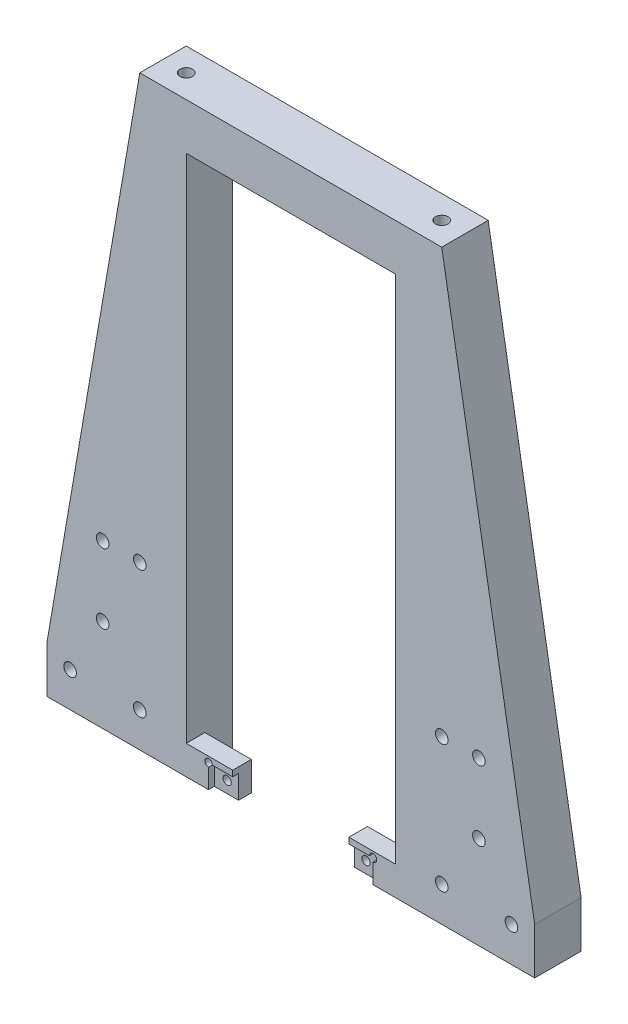
from build123d import *

# Parameters (mm, degrees)
SKETCH1_W              = 12.7
SKETCH1_H              = 12.7
BOSS_EXTRUDE1_DEPTH    = 28.575
SKETCH10_W             = 12.7
SKETCH10_H             = 12.7
BOSS_EXTRUDE6_DEPTH    = 160.3375
SKETCH54_W             = 12.7
SKETCH54_H             = 12.7
BOSS_EXTRUDE10_DEPTH   = 25.4
BOSS_EXTRUDE11_DEPTH   = 12.7
F_8_32_TAPPED_HOLE11_D = 3.4544
F_8_32_TAPPED_HOLE12_D = 3.4544
SKETCH11_W             = 5.08
SKETCH11_H             = 7.9375
BOSS_EXTRUDE12_DEPTH   = 12.7
SKETCH68_W             = 6.604
SKETCH68_H             = 6.35
CUT_EXTRUDE4_DEPTH     = 1.5875
F_4_40_TAPPED_HOLE3_D  = 2.2606
SKETCH71_R             = 1.016
CUT_EXTRUDE5_DEPTH     = 1.5875
F_8_32_TAPPED_HOLE13_D = 3.4544


with BuildPart() as part:
    # Sketch1 → Boss-Extrude1 (new body)
    with BuildSketch(Plane(origin=(0, 0, 0), x_dir=(0, 0, -1), z_dir=(1, 0, 0))):
        with Locations((6.35, -6.35)):
            Rectangle(SKETCH1_W, SKETCH1_H)
    boss_extrude1 = extrude(amount=BOSS_EXTRUDE1_DEPTH)

    # Sketch10 → Boss-Extrude6 (add)
    with BuildSketch(Plane(origin=(0, 0, 0), x_dir=(1, 0, 0), z_dir=(0, 1, 0))):
        with Locations((34.925, 6.35)):
            Rectangle(SKETCH10_W, SKETCH10_H)
    boss_extrude6 = extrude(amount=-BOSS_EXTRUDE6_DEPTH)

    # Sketch54 → Boss-Extrude10 (add)
    with BuildSketch(Plane(origin=(41.275, 0, 0), x_dir=(0, 0, -1), z_dir=(1, 0, 0))):
        with Locations((6.35, -153.9875)):
            Rectangle(SKETCH54_W, SKETCH54_H)
    boss_extrude10 = extrude(amount=BOSS_EXTRUDE10_DEPTH)

    # Sketch55 → Boss-Extrude11 (add)
    with BuildSketch(Plane.XY):
        Polygon((41.275, 0), (66.675, -147.6375), (66.675, -160.3375), (28.575, -160.3375), (28.575, -12.7), (0, -12.7), (0, 0), align=None)
    boss_extrude11 = extrude(amount=-BOSS_EXTRUDE11_DEPTH)

    # Sketch56 → #8-32 Tapped Hole8 (revolve, cut)
    with BuildSketch(Plane(origin=(34.925, 0, -6.35), x_dir=(0, 0, 1), z_dir=(1, 0, 0))):
        Polygon((0, 0), (0, 11.746446461), (1.7272, 10.70864), (1.7272, 0), align=None)
    f_8_32_tapped_hole8 = revolve(axis=Axis((34.925, 6.35, -6.35), (0, -1, 0)), mode=Mode.SUBTRACT)

    # #8-32 Tapped Hole11 (through all)
    with Locations(Plane.XY):
        with Locations((41.275, -115.8875), (51.435, -134.9375)):
            f_8_32_tapped_hole11 = Hole(F_8_32_TAPPED_HOLE11_D / 2)

    # #8-32 Tapped Hole12 (through all)
    with Locations(Plane(origin=(0, 0, -12.7), x_dir=(-1, 0, 0), z_dir=(0, 0, -1))):
        with Locations((-41.275, -150.8125), (-60.325, -150.8125)):
            f_8_32_tapped_hole12 = Hole(F_8_32_TAPPED_HOLE12_D / 2)

    # Sketch11 → Boss-Extrude12 (add)
    with BuildSketch(Plane.ZY.offset(-28.575)):
        with Locations((-2.54, -156.36875)):
            Rectangle(SKETCH11_W, SKETCH11_H)
    boss_extrude12 = extrude(amount=BOSS_EXTRUDE12_DEPTH)

    # Sketch68 → Cut-Extrude4 (cut)
    with BuildSketch(Plane.XY):
        with Locations((19.177, -157.1625)):
            Rectangle(SKETCH68_W, SKETCH68_H)
    cut_extrude4 = extrude(amount=-CUT_EXTRUDE4_DEPTH, mode=Mode.SUBTRACT)

    # #4-40 Tapped Hole3 (through all)
    with Locations(Plane.XY.offset(-1.5875)):
        with Locations((18.987190852, -157.172283572)):
            f_4_40_tapped_hole3 = Hole(F_4_40_TAPPED_HOLE3_D / 2)

    # Sketch71 → Cut-Extrude5 (cut)
    with BuildSketch(Plane.XY):
        with Locations((22.479, -153.9875)):
            Circle(SKETCH71_R)
    cut_extrude5 = extrude(amount=-CUT_EXTRUDE5_DEPTH, mode=Mode.SUBTRACT)

    # Sketch76 → #8-32 Tapped Hole14 (revolve, cut)
    with BuildSketch(Plane(origin=(34.925, -160.3375, -6.35), x_dir=(0, 0, -1), z_dir=(1, 0, 0))):
        Polygon((0, 0), (0, 11.746446461), (1.7272, 10.70864), (1.7272, 0), align=None)
    f_8_32_tapped_hole14 = revolve(axis=Axis((34.925, -166.6875, -6.35), (0, 1, 0)), mode=Mode.SUBTRACT)

    # #8-32 Tapped Hole13 (through all)
    with Locations(Plane.XY):
        with Locations((51.435, -115.8875)):
            f_8_32_tapped_hole13 = Hole(F_8_32_TAPPED_HOLE13_D / 2)

    # Mirror6: Boss-Extrude1, Boss-Extrude6, Boss-Extrude10, Boss-Extrude11, #8-32 Tapped Hole8, #8-32 Tapped Hole11, #8-32 Tapped Hole12, Boss-Extrude12, Cut-Extrude4, #4-40 Tapped Hole3, Cut-Extrude5, #8-32 Tapped Hole14, #8-32 Tapped Hole13 across Right Plane
    add(boss_extrude1.mirror(Plane(origin=(0, 0, 0), x_dir=(0, 0, -1), z_dir=(1, 0, 0))))
    add(boss_extrude6.mirror(Plane(origin=(0, 0, 0), x_dir=(0, 0, -1), z_dir=(1, 0, 0))))
    add(boss_extrude10.mirror(Plane(origin=(0, 0, 0), x_dir=(0, 0, -1), z_dir=(1, 0, 0))))
    add(boss_extrude11.mirror(Plane(origin=(0, 0, 0), x_dir=(0, 0, -1), z_dir=(1, 0, 0))))
    add(f_8_32_tapped_hole8.mirror(Plane(origin=(0, 0, 0), x_dir=(0, 0, -1), z_dir=(1, 0, 0))), mode=Mode.SUBTRACT)
    add(f_8_32_tapped_hole11.mirror(Plane(origin=(0, 0, 0), x_dir=(0, 0, -1), z_dir=(1, 0, 0))), mode=Mode.SUBTRACT)
    add(f_8_32_tapped_hole12.mirror(Plane(origin=(0, 0, 0), x_dir=(0, 0, -1), z_dir=(1, 0, 0))), mode=Mode.SUBTRACT)
    add(boss_extrude12.mirror(Plane(origin=(0, 0, 0), x_dir=(0, 0, -1), z_dir=(1, 0, 0))))
    add(cut_extrude4.mirror(Plane(origin=(0, 0, 0), x_dir=(0, 0, -1), z_dir=(1, 0, 0))), mode=Mode.SUBTRACT)
    add(f_4_40_tapped_hole3.mirror(Plane(origin=(0, 0, 0), x_dir=(0, 0, -1), z_dir=(1, 0, 0))), mode=Mode.SUBTRACT)
    add(cut_extrude5.mirror(Plane(origin=(0, 0, 0), x_dir=(0, 0, -1), z_dir=(1, 0, 0))), mode=Mode.SUBTRACT)
    add(f_8_32_tapped_hole14.mirror(Plane(origin=(0, 0, 0), x_dir=(0, 0, -1), z_dir=(1, 0, 0))), mode=Mode.SUBTRACT)
    add(f_8_32_tapped_hole13.mirror(Plane(origin=(0, 0, 0), x_dir=(0, 0, -1), z_dir=(1, 0, 0))), mode=Mode.SUBTRACT)


solid = part.part
